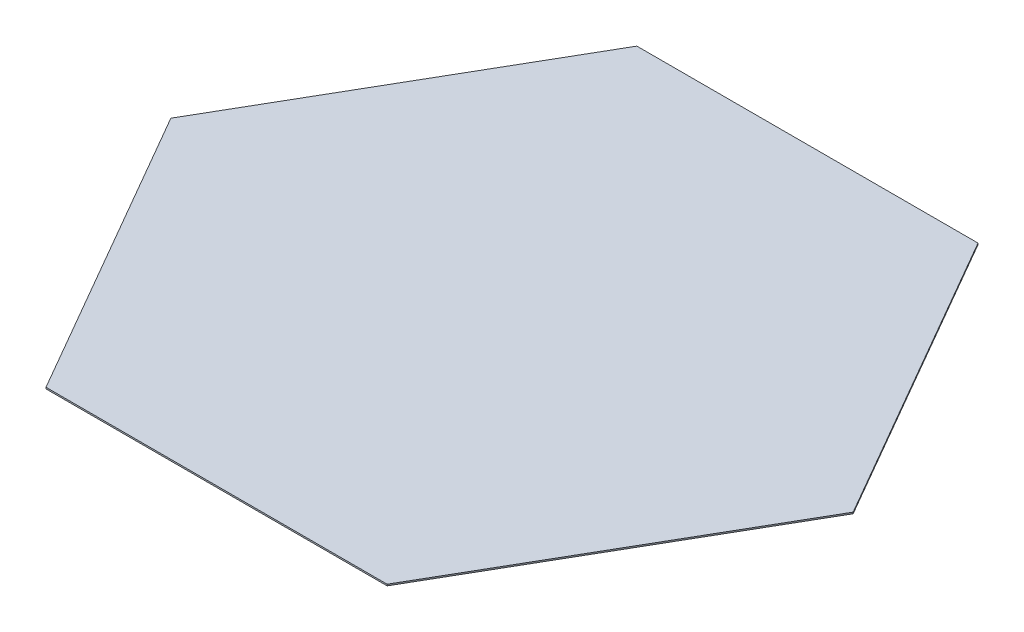
from build123d import *

# Parameters (mm, degrees)
BOSS_EXTRUDE1_DEPTH = 5


with BuildPart() as part:
    # Sketch1 → Boss-Extrude1 (new body)
    with BuildSketch(Plane(origin=(0, 0, 0), x_dir=(1, 0, 0), z_dir=(0, 1, 0))):
        Polygon((1154.700538379, 0), (577.35026919, 1000), (-577.35026919, 1000), (-1154.700538379, 0), (-577.35026919, -1000), (577.35026919, -1000), align=None)
    extrude(amount=BOSS_EXTRUDE1_DEPTH)


solid = part.part
